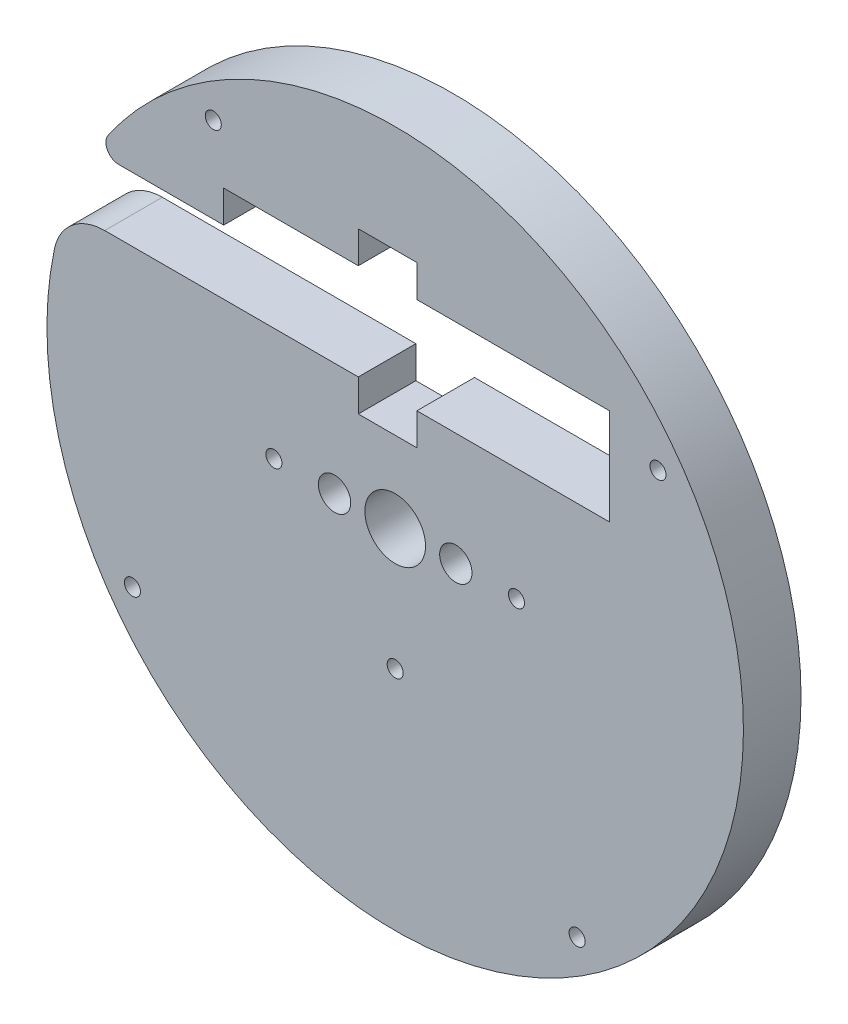
from build123d import *

# Parameters (mm, degrees)
SKETCH1_R                = 34.458333333
SKETCH1_R_2              = 3
BOSS_EXTRUDE1_DEPTH      = 5.7
CUT_EXTRUDE2_DEPTH       = 50.063667537
FILLET1_R                = 5.08
FILLET2_R                = 1.27
SKETCH2_R                = 0.79375
CUT_EXTRUDE1_DEPTH       = 50.063667537
M3_CLEARANCE_HOLE2_D     = 3.2
M3_CLEARANCE_HOLE2_DEPTH = 12.7
M3_CLEARANCE_HOLE2_TIP   = 0.96137699


with BuildPart() as part:
    # Sketch1 → Boss-Extrude1 (new body)
    with BuildSketch(Plane.XY):
        Circle(SKETCH1_R)
        Circle(SKETCH1_R_2, mode=Mode.SUBTRACT)
    extrude(amount=BOSS_EXTRUDE1_DEPTH)

    # Sketch3 → Cut-Extrude2 (cut, through all)
    with BuildSketch(Plane.XY.offset(5.7)):
        with BuildLine():
            Line((-3.652101058, 11.175), (-32.595952373, 11.175))
            ThreePointArc((-32.595952373, 11.175), (-31.293969256, 14.424431508), (-29.669026123, 17.525))
            Line((-29.669026123, 17.525), (-16.969026123, 17.525))
            Line((-16.969026123, 17.525), (-16.969026123, 20.7))
            Line((-16.969026123, 20.7), (-3.652101058, 20.7))
            Line((-3.652101058, 20.7), (-3.652101058, 23.875))
            Line((-3.652101058, 23.875), (2.147898942, 23.875))
            Line((2.147898942, 23.875), (2.147898942, 20.7))
            Line((2.147898942, 20.7), (21.197898942, 20.7))
            Line((21.197898942, 20.7), (21.197898942, 11.175))
            Line((21.197898942, 11.175), (2.147898942, 11.175))
            Line((2.147898942, 11.175), (2.147898942, 8))
            Line((2.147898942, 8), (-3.652101058, 8))
            Line((-3.652101058, 8), (-3.652101058, 11.175))
        make_face()
    extrude(amount=-CUT_EXTRUDE2_DEPTH, mode=Mode.SUBTRACT)

    # Fillet1
    fillet1_edges = [part.edges().sort_by_distance(p)[0] for p in [
        (-32.595952373, 11.175, 2.85),
    ]]
    fillet(fillet1_edges, radius=FILLET1_R)

    # Fillet2
    fillet2_edges = [part.edges().sort_by_distance(p)[0] for p in [
        (-29.669026123, 17.525, 2.85),
    ]]
    fillet(fillet2_edges, radius=FILLET2_R)

    # Sketch2 → Cut-Extrude1 (cut, through all)
    with BuildSketch(Plane.XY.offset(5.7)):
        with Locations((0, 12)):
            Circle(SKETCH2_R)
        with Locations((12, 0)):
            Circle(SKETCH2_R)
        with Locations((0, -12)):
            Circle(SKETCH2_R)
        with Locations((-12, 0)):
            Circle(SKETCH2_R)
        with Locations((-18, 26)):
            Circle(SKETCH2_R)
        with Locations((26, 18)):
            Circle(SKETCH2_R)
        with Locations((18, -26)):
            Circle(SKETCH2_R)
        with Locations((-26, -18)):
            Circle(SKETCH2_R)
    extrude(amount=-CUT_EXTRUDE1_DEPTH, mode=Mode.SUBTRACT)

    # M3 Clearance Hole2
    with Locations(Plane.XY.offset(5.7)):
        with Locations((-6, 0), (6, 0)):
            Hole(M3_CLEARANCE_HOLE2_D / 2, depth=M3_CLEARANCE_HOLE2_DEPTH)
            with Locations((0, 0, -(M3_CLEARANCE_HOLE2_DEPTH + M3_CLEARANCE_HOLE2_TIP / 2))):  # 118° drill point
                Cone(0, M3_CLEARANCE_HOLE2_D / 2, M3_CLEARANCE_HOLE2_TIP, mode=Mode.SUBTRACT)


solid = part.part
